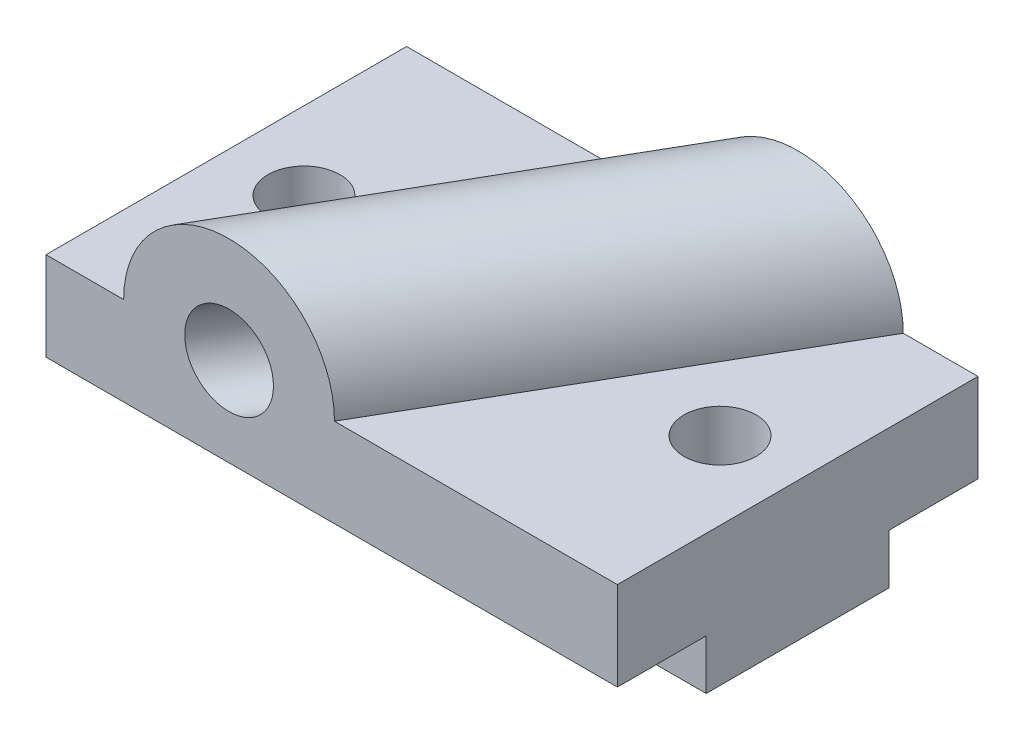
from build123d import *

# Parameters (mm, degrees)
BOSS_EXTRUDE1_DEPTH = 51.5
SKETCH2_R           = 6.5
CUT_EXTRUDE1_DEPTH  = 66.829324772
BOSS_EXTRUDE4_DEPTH = 75.055534995
SKETCH7_R           = 8
CUT_EXTRUDE3_DEPTH  = 86.666666667


with BuildPart() as part:
    # Sketch1 → Boss-Extrude1 (new, symmetric)
    with BuildSketch(Plane(origin=(0, 0, 0), x_dir=(0, 0, -1), z_dir=(1, 0, 0))):
        Polygon((32.5, 0), (-32.5, 0), (-32.5, -16), (-16.5, -16), (-16.5, -25), (16.5, -25), (16.5, -16), (32.5, -16), align=None)
    extrude(amount=BOSS_EXTRUDE1_DEPTH, both=True)

    # Sketch2 → Cut-Extrude1 (cut, through all)
    with BuildSketch(Plane(origin=(0, 0, 0), x_dir=(1, 0, 0), z_dir=(0, 1, 0))):
        with Locations(Location((-37.5, 0, 0), (0, 0, 270))):
            Circle(SKETCH2_R)
    cut_extrude1 = extrude(amount=-CUT_EXTRUDE1_DEPTH, mode=Mode.SUBTRACT)

    # Mirror1: Cut-Extrude1 across plane
    add(cut_extrude1.mirror(Plane(origin=(0, 0, 0), x_dir=(0, 0, 1), z_dir=(1, 0, 0))), mode=Mode.SUBTRACT)

    # Sketch5 → Boss-Extrude4 (add, along a direction that is not the sketch's normal)
    with BuildSketch(Plane.XY.offset(32.5)):
        with BuildLine():
            Line((0.5, 0), (-37.5, 0))
            ThreePointArc((-37.5, 0), (-18.5, 19), (0.5, 0))
        make_face()
    extrude(amount=-BOSS_EXTRUDE4_DEPTH, dir=(-0.5000000000000041, 0, 0.8660254037844363))

    # Sketch7 → Cut-Extrude3 (cut, along a direction that is not the sketch's normal)
    with BuildSketch(Plane.XY.offset(32.5)):
        with Locations((-18.5, 0)):
            Circle(SKETCH7_R)
    extrude(amount=-CUT_EXTRUDE3_DEPTH, dir=(-0.5000000000000041, 0, 0.8660254037844363), mode=Mode.SUBTRACT)


solid = part.part
